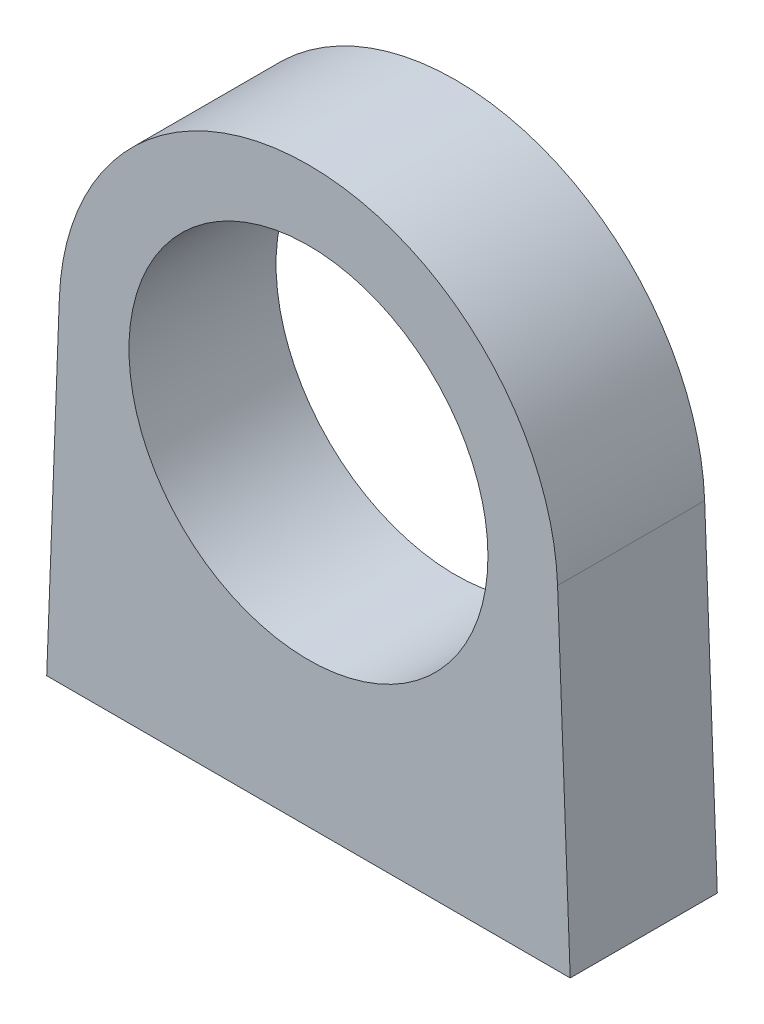
from build123d import *

# Parameters (mm, degrees)
SKETCH1_R           = 7.2
BOSS_EXTRUDE1_DEPTH = 2.95
SKETCH2_R           = 1.25
CUT_EXTRUDE1_DEPTH  = 5


with BuildPart() as part:
    # Sketch1 → Boss-Extrude1 (new, symmetric)
    with BuildSketch(Plane.XY):
        with BuildLine():
            Line((-9.992822271, 13.378817988), (-10.5, 0))
            Line((-10.5, 0), (10.5, 0))
            Line((10.5, 0), (9.992822271, 13.378817988))
            ThreePointArc((9.992822271, 13.378817988), (0, 23), (-9.992822271, 13.378817988))
        make_face()
        with Locations((0, 13)):
            Circle(SKETCH1_R, mode=Mode.SUBTRACT)
    extrude(amount=BOSS_EXTRUDE1_DEPTH, both=True)

    # Sketch2 → Cut-Extrude1 (cut)
    with BuildSketch(Plane.XZ):
        with Locations(Location((-6.95, 0, 0), (0, 0, 270))):
            Circle(SKETCH2_R)
        with Locations(Location((6.95, 0, 0), (0, 0, 270))):
            Circle(SKETCH2_R)
    extrude(amount=-CUT_EXTRUDE1_DEPTH, mode=Mode.SUBTRACT)


solid = part.part
